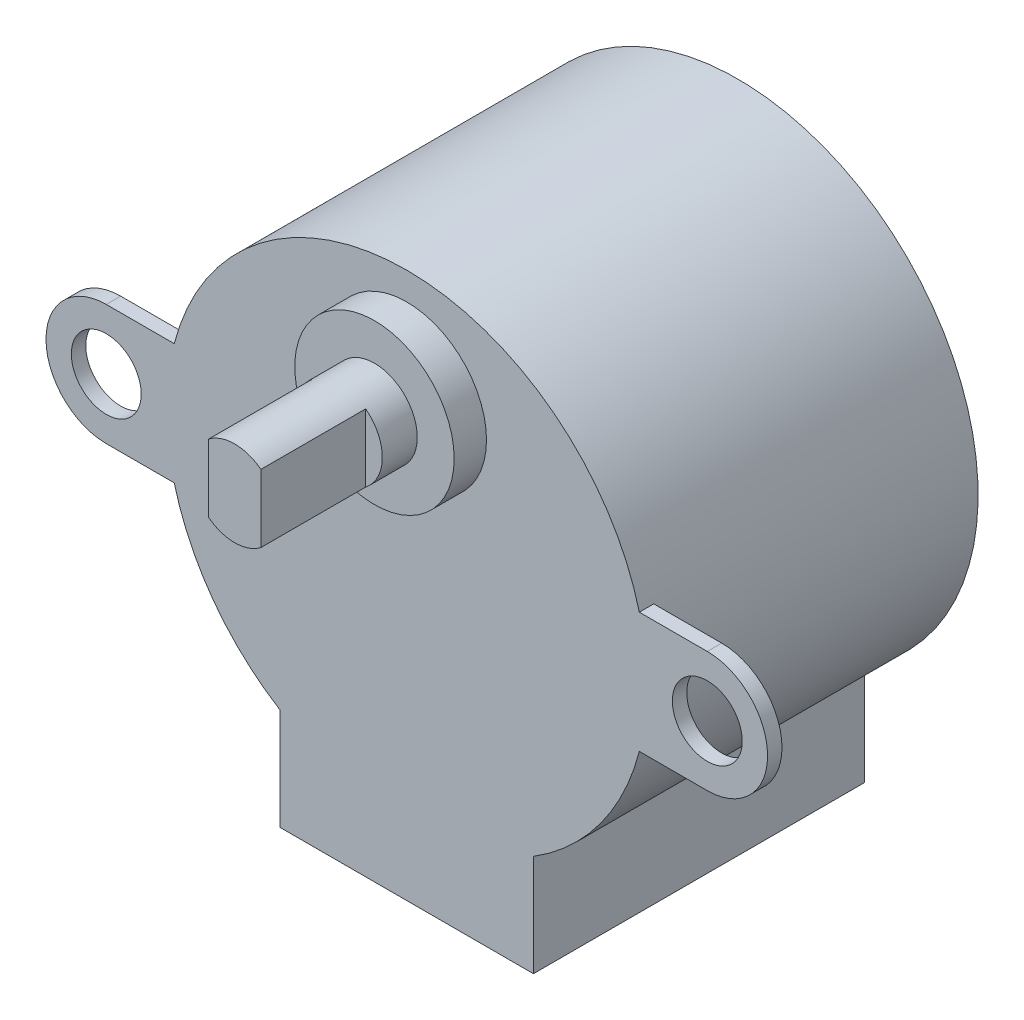
from build123d import *

# Parameters (mm, degrees)
BOSS_EXTRUDE1_DEPTH = 19.2532
BOSS_EXTRUDE2_START = -0.8382
SKETCH2_R           = 2.032
BOSS_EXTRUDE2_DEPTH = 0.8382
SKETCH3_R           = 4.6355
BOSS_EXTRUDE3_DEPTH = 1.8796
SKETCH4_R           = 2.4892
BOSS_EXTRUDE4_DEPTH = 8.128
CUT_EXTRUDE1_START  = -6.096
CUT_EXTRUDE1_DEPTH  = 6.096


with BuildPart() as part:
    # Sketch1 → Boss-Extrude1 (new body)
    with BuildSketch(Plane.XY):
        with BuildLine():
            Line((-7.366, -17.78), (7.366, -17.78))
            Line((7.366, -17.78), (7.366, -11.870254589))
            ThreePointArc((7.366, -11.870254589), (0, 13.97), (-7.366, -11.870254589))
            Line((-7.366, -11.870254589), (-7.366, -17.78))
        make_face()
    extrude(amount=BOSS_EXTRUDE1_DEPTH)

    # Sketch2 → Boss-Extrude2 (add)
    # profile 1 of 2: a face of its own
    with BuildSketch(Plane.XY.offset(19.2532).offset(BOSS_EXTRUDE2_START)):
        with BuildLine():
            Line((-13.52310885, -3.5052), (-17.4752, -3.5052))
            ThreePointArc((-17.4752, -3.5052), (-20.9804, 0), (-17.4752, 3.5052))
            Line((-17.4752, 3.5052), (-13.52310885, 3.5052))
            ThreePointArc((-13.52310885, 3.5052), (-13.97, 0), (-13.52310885, -3.5052))
        make_face()
        with Locations((-17.4752, 0)):
            Circle(SKETCH2_R, mode=Mode.SUBTRACT)
    # profile 2 of 2: a face of its own
    with BuildSketch(Plane.XY.offset(19.2532).offset(BOSS_EXTRUDE2_START)):
        with BuildLine():
            Line((13.52310885, 3.5052), (17.4752, 3.5052))
            ThreePointArc((17.4752, 3.5052), (20.9804, 0), (17.4752, -3.5052))
            Line((17.4752, -3.5052), (13.52310885, -3.5052))
            ThreePointArc((13.52310885, -3.5052), (13.97, 0), (13.52310885, 3.5052))
        make_face()
        with Locations(Location((17.4752, 0, 0), (0, 0, 180))):
            Circle(SKETCH2_R, mode=Mode.SUBTRACT)
    extrude(amount=BOSS_EXTRUDE2_DEPTH)

    # Sketch3 → Boss-Extrude3 (add)
    with BuildSketch(Plane.XY.offset(19.2532)):
        with Locations((0, 7.7343)):
            Circle(SKETCH3_R)
    extrude(amount=BOSS_EXTRUDE3_DEPTH)

    # Sketch4 → Boss-Extrude4 (add)
    with BuildSketch(Plane.XY.offset(21.1328)):
        with Locations((0, 7.7343)):
            Circle(SKETCH4_R)
    extrude(amount=BOSS_EXTRUDE4_DEPTH)

    # Sketch5 → Cut-Extrude1 (cut)
    with BuildSketch(Plane.XY.offset(29.2608).offset(CUT_EXTRUDE1_START)):
        with BuildLine():
            Line((-1.524, 9.702431256), (-1.524, 5.766168744))
            ThreePointArc((-1.524, 5.766168744), (-2.4892, 7.7343), (-1.524, 9.702431256))
        make_face()
        with BuildLine():
            Line((1.524, 9.702431256), (1.524, 5.766168744))
            ThreePointArc((1.524, 5.766168744), (2.4892, 7.7343), (1.524, 9.702431256))
        make_face()
    extrude(amount=CUT_EXTRUDE1_DEPTH, mode=Mode.SUBTRACT)


solid = part.part
